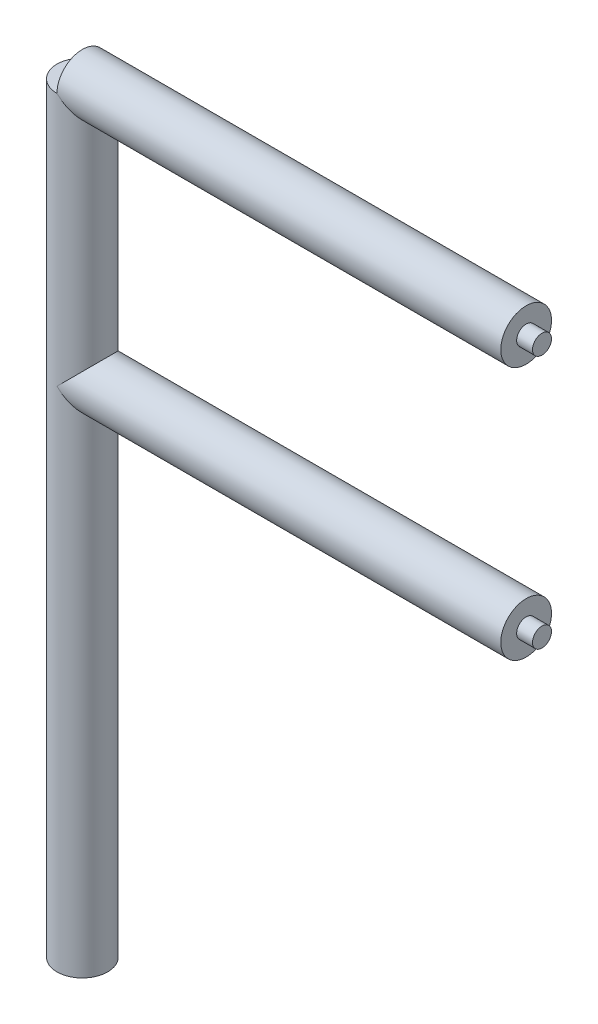
from build123d import *

# Parameters (mm, degrees)
SKETCH1_R           = 4
BOSS_EXTRUDE1_DEPTH = 80
SKETCH3_R           = 4
BOSS_EXTRUDE3_DEPTH = 70
BOSS_EXTRUDE4_START = 40
SKETCH4_R           = 4
BOSS_EXTRUDE4_DEPTH = 40
SKETCH5_R           = 4
BOSS_EXTRUDE5_DEPTH = 70
SKETCH7_R           = 1.5
BOSS_EXTRUDE6_DEPTH = 2.5


with BuildPart() as part:
    # Sketch1 → Boss-Extrude1 (new body)
    with BuildSketch(Plane(origin=(0, 0, 0), x_dir=(1, 0, 0), z_dir=(0, 1, 0))):
        with Locations(Location((0, 0, 0), (0, 0, 270))):
            Circle(SKETCH1_R)
    extrude(amount=-BOSS_EXTRUDE1_DEPTH)

    # Sketch3 → Boss-Extrude3 (add)
    with BuildSketch(Plane(origin=(0, 0, 0), x_dir=(0, 0, -1), z_dir=(1, 0, 0))):
        Circle(SKETCH3_R)
    extrude(amount=BOSS_EXTRUDE3_DEPTH)

    # Sketch4 → Boss-Extrude4 (add)
    with BuildSketch(Plane(origin=(0, 0, 0), x_dir=(1, 0, 0), z_dir=(0, 1, 0)).offset(BOSS_EXTRUDE4_START)):
        with Locations(Location((0, 0, 0), (0, 0, 270))):
            Circle(SKETCH4_R)
    extrude(amount=-BOSS_EXTRUDE4_DEPTH)

    # Sketch5 → Boss-Extrude5 (add)
    with BuildSketch(Plane(origin=(0, 0, 0), x_dir=(0, 0, -1), z_dir=(1, 0, 0))):
        with Locations((0, 40)):
            Circle(SKETCH5_R)
    extrude(amount=BOSS_EXTRUDE5_DEPTH)

    # Sketch7 → Boss-Extrude6 (add)
    with BuildSketch(Plane(origin=(70, 0, 0), x_dir=(0, 0, -1), z_dir=(1, 0, 0))):
        with Locations((0, 40)):
            Circle(SKETCH7_R)
        Circle(SKETCH7_R)
    extrude(amount=BOSS_EXTRUDE6_DEPTH)


solid = part.part
